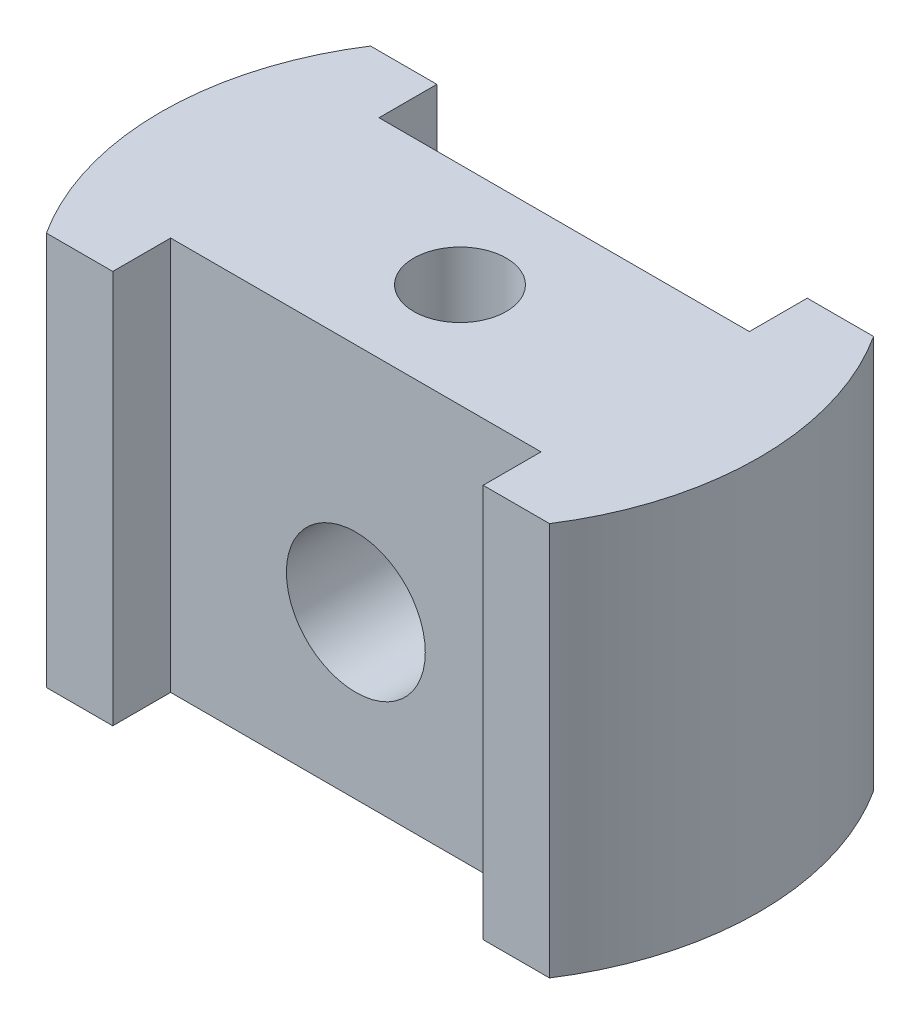
from build123d import *

# Parameters (mm, degrees)
BOSS_EXTRUDE1_DEPTH             = 8.5
TAP_DRILL_FOR_M4X0_7_TAP1_D     = 4
TAP_DRILL_FOR_M4X0_7_TAP1_DEPTH = 5.298278762
TAP_DRILL_FOR_M4X0_7_TAP1_TIP   = 1.201721238
CUT_EXTRUDE1_DEPTH              = 17.980360556
CUT_EXTRUDE1_DEPTH_BACK         = 17.980360556
SKETCH5_R                       = 3


with BuildPart() as part:
    # Sketch1 → Boss-Extrude1 (new, symmetric)
    with BuildSketch(Plane(origin=(0, 0, 0), x_dir=(1, 0, 0), z_dir=(0, 1, 0))):
        with BuildLine():
            Line((-8, 7), (-8, 4.5))
            Line((-8, 4.5), (8, 4.5))
            Line((8, 4.5), (8, 7))
            Line((8, 7), (10.866583853, 7))
            ThreePointArc((10.866583853, 7), (12.926045204, 0), (10.866583853, -7))
            Line((10.866583853, -7), (8, -7))
            Line((8, -7), (8, -4.5))
            Line((8, -4.5), (-8, -4.5))
            Line((-8, -4.5), (-8, -7))
            Line((-8, -7), (-10.866583853, -7))
            ThreePointArc((-10.866583853, -7), (-12.926045204, 0), (-10.866583853, 7))
            Line((-10.866583853, 7), (-8, 7))
        make_face()
    extrude(amount=BOSS_EXTRUDE1_DEPTH, both=True)

    # Tap Drill for M4x0.7 Tap1
    with Locations(Plane(origin=(0, 8.5, 0), x_dir=(1, 0, 0), z_dir=(0, 1, 0))):
        with Locations((0, 0)):
            Hole(TAP_DRILL_FOR_M4X0_7_TAP1_D / 2, depth=TAP_DRILL_FOR_M4X0_7_TAP1_DEPTH)
            with Locations((0, 0, -(TAP_DRILL_FOR_M4X0_7_TAP1_DEPTH + TAP_DRILL_FOR_M4X0_7_TAP1_TIP / 2))):  # 118° drill point
                Cone(0, TAP_DRILL_FOR_M4X0_7_TAP1_D / 2, TAP_DRILL_FOR_M4X0_7_TAP1_TIP, mode=Mode.SUBTRACT)

    # Sketch5 → Cut-Extrude1 (cut, two sides: drawn at the far end of the back side and taken through both)
    with BuildSketch(Plane.XY.offset(-CUT_EXTRUDE1_DEPTH_BACK)):
        with Locations((0, -1.5)):
            Circle(SKETCH5_R)
    extrude(amount=CUT_EXTRUDE1_DEPTH + CUT_EXTRUDE1_DEPTH_BACK, mode=Mode.SUBTRACT)


solid = part.part
